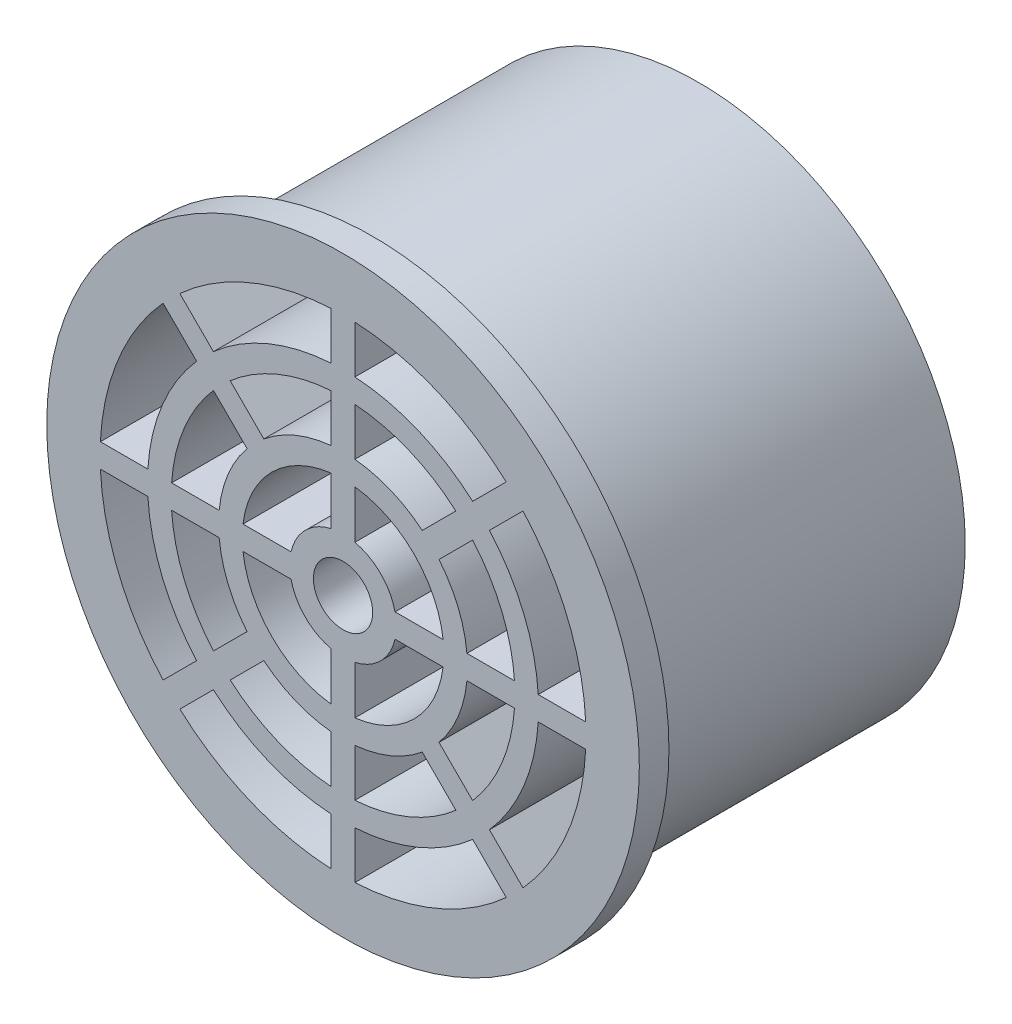
from build123d import *

# Parameters (mm, degrees)
SKETCH1_R           = 10
BOSS_EXTRUDE1_DEPTH = 1
SKETCH2_R           = 9
BOSS_EXTRUDE2_DEPTH = 11
SKETCH3_R           = 1
CUT_EXTRUDE2_DEPTH  = 19.547236991


with BuildPart() as part:
    # Sketch1 → Boss-Extrude1 (new body)
    with BuildSketch(Plane.XY):
        Circle(SKETCH1_R)
    extrude(amount=BOSS_EXTRUDE1_DEPTH)

    # Sketch2 → Boss-Extrude2 (add)
    with BuildSketch(Plane(origin=(0, 0, 0), x_dir=(-1, 0, 0), z_dir=(0, 0, -1))):
        Circle(SKETCH2_R)
    extrude(amount=BOSS_EXTRUDE2_DEPTH)

    # Sketch3 → Cut-Extrude2 (cut, through all)
    with BuildSketch(Plane.XY.offset(1)):
        Circle(SKETCH3_R)
        with BuildLine():
            ThreePointArc((-1.754992877, 0.4), (-1.272792206, 1.272792206), (-0.4, 1.754992877))
            Line((-0.4, 1.754992877), (-0.4, 3.376388603))
            ThreePointArc((-0.4, 3.376388603), (-2.404163056, 2.404163056), (-3.376388603, 0.4))
            Line((-3.376388603, 0.4), (-1.754992877, 0.4))
        make_face()
        with BuildLine():
            Line((0.4, 3.376388603), (0.4, 1.754992877))
            ThreePointArc((0.4, 1.754992877), (1.272792206, 1.272792206), (1.754992877, 0.4))
            Line((1.754992877, 0.4), (3.376388603, 0.4))
            ThreePointArc((3.376388603, 0.4), (2.404163056, 2.404163056), (0.4, 3.376388603))
        make_face()
        with BuildLine():
            Line((3.376388603, -0.4), (1.754992877, -0.4))
            ThreePointArc((1.754992877, -0.4), (1.272792206, -1.272792206), (0.4, -1.754992877))
            Line((0.4, -1.754992877), (0.4, -3.376388603))
            ThreePointArc((0.4, -3.376388603), (2.404163056, -2.404163056), (3.376388603, -0.4))
        make_face()
        with BuildLine():
            ThreePointArc((-0.4, -1.754992877), (-1.272792206, -1.272792206), (-1.754992877, -0.4))
            Line((-1.754992877, -0.4), (-3.376388603, -0.4))
            ThreePointArc((-3.376388603, -0.4), (-2.404163056, -2.404163056), (-0.4, -3.376388603))
            Line((-0.4, -3.376388603), (-0.4, -1.754992877))
        make_face()
        with BuildLine():
            ThreePointArc((0.4, 4.180908992), (1.607270416, 3.880294037), (2.673506387, 3.239191812))
            Line((2.673506387, 3.239191812), (3.808611797, 4.374297222))
            ThreePointArc((3.808611797, 4.374297222), (2.219563908, 5.358501289), (0.4, 5.786190457))
            Line((0.4, 5.786190457), (0.4, 4.180908992))
        make_face()
        with BuildLine():
            ThreePointArc((-2.673506387, 3.239191812), (-1.607270416, 3.880294037), (-0.4, 4.180908992))
            Line((-0.4, 4.180908992), (-0.4, 5.786190457))
            ThreePointArc((-0.4, 5.786190457), (-2.219563908, 5.358501289), (-3.808611797, 4.374297222))
            Line((-3.808611797, 4.374297222), (-2.673506387, 3.239191812))
        make_face()
        with BuildLine():
            ThreePointArc((-4.180908992, 0.4), (-3.880294037, 1.607270416), (-3.239191812, 2.673506387))
            Line((-3.239191812, 2.673506387), (-4.374297222, 3.808611797))
            ThreePointArc((-4.374297222, 3.808611797), (-5.358501289, 2.219563908), (-5.786190457, 0.4))
            Line((-5.786190457, 0.4), (-4.180908992, 0.4))
        make_face()
        with BuildLine():
            ThreePointArc((-3.239191812, -2.673506387), (-3.880294037, -1.607270416), (-4.180908992, -0.4))
            Line((-4.180908992, -0.4), (-5.786190457, -0.4))
            ThreePointArc((-5.786190457, -0.4), (-5.358501289, -2.219563908), (-4.374297222, -3.808611797))
            Line((-4.374297222, -3.808611797), (-3.239191812, -2.673506387))
        make_face()
        with BuildLine():
            Line((-0.4, -5.786190457), (-0.4, -4.180908992))
            ThreePointArc((-0.4, -4.180908992), (-1.607270416, -3.880294037), (-2.673506387, -3.239191812))
            Line((-2.673506387, -3.239191812), (-3.808611797, -4.374297222))
            ThreePointArc((-3.808611797, -4.374297222), (-2.219563908, -5.358501289), (-0.4, -5.786190457))
        make_face()
        with BuildLine():
            Line((3.808611797, -4.374297222), (2.673506387, -3.239191812))
            ThreePointArc((2.673506387, -3.239191812), (1.607270416, -3.880294037), (0.4, -4.180908992))
            Line((0.4, -4.180908992), (0.4, -5.786190457))
            ThreePointArc((0.4, -5.786190457), (2.219563908, -5.358501289), (3.808611797, -4.374297222))
        make_face()
        with BuildLine():
            Line((5.786190457, -0.4), (4.180908992, -0.4))
            ThreePointArc((4.180908992, -0.4), (3.880294037, -1.607270416), (3.239191812, -2.673506387))
            Line((3.239191812, -2.673506387), (4.374297222, -3.808611797))
            ThreePointArc((4.374297222, -3.808611797), (5.358501289, -2.219563908), (5.786190457, -0.4))
        make_face()
        with BuildLine():
            Line((4.374297222, 3.808611797), (3.239191812, 2.673506387))
            ThreePointArc((3.239191812, 2.673506387), (3.880294037, 1.607270416), (4.180908992, 0.4))
            Line((4.180908992, 0.4), (5.786190457, 0.4))
            ThreePointArc((5.786190457, 0.4), (5.358501289, 2.219563908), (4.374297222, 3.808611797))
        make_face()
        with BuildLine():
            ThreePointArc((8.190238092, 0.4), (7.575812167, 3.138004145), (6.074215607, 5.508530182))
            Line((6.074215607, 5.508530182), (4.941168592, 4.375483167))
            ThreePointArc((4.941168592, 4.375483167), (6.097604915, 2.525710654), (6.587867637, 0.4))
            Line((6.587867637, 0.4), (8.190238092, 0.4))
        make_face()
        with BuildLine():
            ThreePointArc((5.508530182, 6.074215607), (3.138004145, 7.575812167), (0.4, 8.190238092))
            Line((0.4, 8.190238092), (0.4, 6.587867637))
            ThreePointArc((0.4, 6.587867637), (2.525710654, 6.097604915), (4.375483167, 4.941168592))
            Line((4.375483167, 4.941168592), (5.508530182, 6.074215607))
        make_face()
        with BuildLine():
            Line((-0.4, 6.587867637), (-0.4, 8.190238092))
            ThreePointArc((-0.4, 8.190238092), (-3.138004145, 7.575812167), (-5.508530182, 6.074215607))
            Line((-5.508530182, 6.074215607), (-4.375483167, 4.941168592))
            ThreePointArc((-4.375483167, 4.941168592), (-2.525710654, 6.097604915), (-0.4, 6.587867637))
        make_face()
        with BuildLine():
            Line((-4.941168592, 4.375483167), (-6.074215607, 5.508530182))
            ThreePointArc((-6.074215607, 5.508530182), (-7.575812167, 3.138004145), (-8.190238092, 0.4))
            Line((-8.190238092, 0.4), (-6.587867637, 0.4))
            ThreePointArc((-6.587867637, 0.4), (-6.097604915, 2.525710654), (-4.941168592, 4.375483167))
        make_face()
        with BuildLine():
            Line((-6.587867637, -0.4), (-8.190238092, -0.4))
            ThreePointArc((-8.190238092, -0.4), (-7.575812167, -3.138004145), (-6.074215607, -5.508530182))
            Line((-6.074215607, -5.508530182), (-4.941168592, -4.375483167))
            ThreePointArc((-4.941168592, -4.375483167), (-6.097604915, -2.525710654), (-6.587867637, -0.4))
        make_face()
        with BuildLine():
            Line((-4.375483167, -4.941168592), (-5.508530182, -6.074215607))
            ThreePointArc((-5.508530182, -6.074215607), (-3.138004145, -7.575812167), (-0.4, -8.190238092))
            Line((-0.4, -8.190238092), (-0.4, -6.587867637))
            ThreePointArc((-0.4, -6.587867637), (-2.525710654, -6.097604915), (-4.375483167, -4.941168592))
        make_face()
        with BuildLine():
            ThreePointArc((0.4, -8.190238092), (3.138004145, -7.575812167), (5.508530182, -6.074215607))
            Line((5.508530182, -6.074215607), (4.375483167, -4.941168592))
            ThreePointArc((4.375483167, -4.941168592), (2.525710654, -6.097604915), (0.4, -6.587867637))
            Line((0.4, -6.587867637), (0.4, -8.190238092))
        make_face()
        with BuildLine():
            ThreePointArc((6.074215607, -5.508530182), (7.575812167, -3.138004145), (8.190238092, -0.4))
            Line((8.190238092, -0.4), (6.587867637, -0.4))
            ThreePointArc((6.587867637, -0.4), (6.097604915, -2.525710654), (4.941168592, -4.375483167))
            Line((4.941168592, -4.375483167), (6.074215607, -5.508530182))
        make_face()
    extrude(amount=-CUT_EXTRUDE2_DEPTH, mode=Mode.SUBTRACT)


solid = part.part
